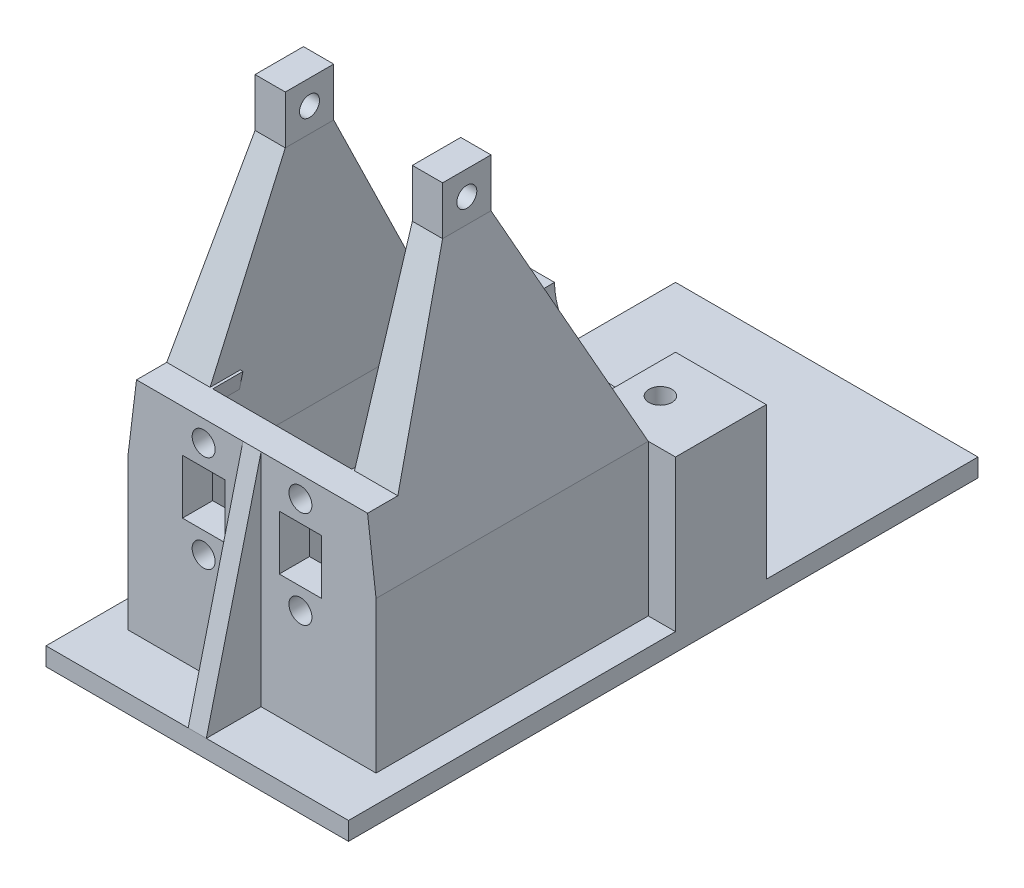
from build123d import *

# Parameters (mm, degrees)
MOTOR_MOUNT_SOLID_DEPTH              = 7.5
ENCODER_DISTANCE_SKETCH_W            = 50
ENCODER_DISTANCE_SKETCH_H            = 55
ENCODER_DISTANCE_SOLID_DEPTH         = 5
ENCODER_MOUNT_SKETCH_R               = 1.9
ENCODER_MOUNT_SKETCH_W               = 7
ENCODER_MOUNT_SKETCH_H               = 9
ENCODER_MOUNT_SOLID_DEPTH            = 5
MOTOR_CLAMP_MOUNTING_HOLES_SKETCH_R  = 1.9
MOTOR_CLAMP_MOUNTING_HOLES_CUT_DEPTH = 16
GUSSET_PLATE_SKETCH_W                = 50
GUSSET_PLATE_SKETCH_H                = 5
GUSSET_PLATE_SOLID_DEPTH             = 16.5
GUSSET_SOLID_DEPTH                   = 1.5
MOUNTING_PLATE_SKETCH_W              = 50
MOUNTING_PLATE_SKETCH_H              = 92
MOUNTING_PLATE_SKETCH_R              = 2.65
MOUNTING_PLATE_SOLID_DEPTH           = 5
MOUNTING_HOLES_CUT_DEPTH             = 100.036609393
MOUNTING_HOLES_CUT_DEPTH_BACK        = 100.036609393
MOUNTING_HOLE_SKETCH_R               = 2.65
MOUNTING_PLATE_TRIM_SKETCH_W         = 50
MOUNTING_PLATE_TRIM_SKETCH_H         = 15.5
MOUNTING_PLATE_TRIM_SKETCH_H_2       = 40
MOUNTING_PLATE_TRIM_SKETCH_W_2       = 23.5
MOUNTING_PLATE_TRIM_SKETCH_H_3       = 16.5
MOUNTING_PLATE_TRIM_CUT_DEPTH        = 2
CUT_EXTRUDE1_DEPTH                   = 105.216121594
CUT_EXTRUDE1_DEPTH_BACK              = 105.216121594
SKETCH1_W                            = 92
SKETCH1_H                            = 35
SKETCH2_W                            = 50
SKETCH2_H                            = 104.056390977
BOSS_EXTRUDE1_DEPTH                  = 3
SKETCH3_W                            = 8
SKETCH3_H                            = 40
BOSS_EXTRUDE2_DEPTH                  = 25
BOSS_EXTRUDE3_DEPTH                  = 40
CUT_EXTRUDE2_DEPTH                   = 89.489769297
CUT_EXTRUDE2_DEPTH_BACK              = 89.489769297
SKETCH5_R                            = 1.65
CUT_EXTRUDE3_DEPTH                   = 89.489769297
CUT_EXTRUDE3_DEPTH_BACK              = 89.489769297
BOSS_EXTRUDE4_DEPTH                  = 10


with BuildPart() as part:
    # Mouting Mount Sketch → Motor Mount Solid (new, symmetric)
    with BuildSketch(Plane.XY):
        with BuildLine():
            Line((-25, -55), (25, -55))
            Line((25, -55), (25, 0))
            Line((25, 0), (10, 0))
            ThreePointArc((10, 0), (0, -10), (-10, 0))
            Line((-10, 0), (-25, 0))
            Line((-25, 0), (-25, -55))
        make_face()
    extrude(amount=MOTOR_MOUNT_SOLID_DEPTH, both=True)

    # Encoder Distance Sketch → Encoder Distance Solid (add)
    with BuildSketch(Plane.XZ.offset(55)):
        with Locations((0, 20)):
            Rectangle(ENCODER_DISTANCE_SKETCH_W, ENCODER_DISTANCE_SKETCH_H)
    extrude(amount=ENCODER_DISTANCE_SOLID_DEPTH)

    # Encoder Mount Sketch → Encoder Mount Solid (add)
    with BuildSketch(Plane.XY.offset(47.5)):
        Polygon((-25, -60), (-25, -55), (-11.5, 11.5), (11.5, 11.5), (25, -55), (25, -60), align=None)
        with Locations((-8, 8)):
            Circle(ENCODER_MOUNT_SKETCH_R, mode=Mode.SUBTRACT)
        with Locations((8, 8)):
            Circle(ENCODER_MOUNT_SKETCH_R, mode=Mode.SUBTRACT)
        with Locations((-8, -8)):
            Circle(ENCODER_MOUNT_SKETCH_R, mode=Mode.SUBTRACT)
        with Locations((8, -8)):
            Circle(ENCODER_MOUNT_SKETCH_R, mode=Mode.SUBTRACT)
        with Locations((-8, 0)):
            Rectangle(ENCODER_MOUNT_SKETCH_W, ENCODER_MOUNT_SKETCH_H, mode=Mode.SUBTRACT)
        with Locations((8, 0)):
            Rectangle(ENCODER_MOUNT_SKETCH_W, ENCODER_MOUNT_SKETCH_H, mode=Mode.SUBTRACT)
    extrude(amount=ENCODER_MOUNT_SOLID_DEPTH)

    # Motor Clamp Mounting Holes Sketch → Motor Clamp Mounting Holes Cut (cut)
    with BuildSketch(Plane(origin=(0, 0, 0), x_dir=(1, 0, 0), z_dir=(0, 1, 0))):
        with Locations(Location((-15, 0, 0), (0, 0, 180))):
            Circle(MOTOR_CLAMP_MOUNTING_HOLES_SKETCH_R)
        with Locations(Location((15, 0, 0), (0, 0, 180))):
            Circle(MOTOR_CLAMP_MOUNTING_HOLES_SKETCH_R)
    extrude(amount=-MOTOR_CLAMP_MOUNTING_HOLES_CUT_DEPTH, mode=Mode.SUBTRACT)

    # Gusset Plate Sketch → Gusset Plate Solid (add)
    with BuildSketch(Plane.XY.offset(52.5)):
        with Locations((0, -57.5)):
            Rectangle(GUSSET_PLATE_SKETCH_W, GUSSET_PLATE_SKETCH_H)
    extrude(amount=GUSSET_PLATE_SOLID_DEPTH)

    # Gusset Sketch → Gusset Solid (add, symmetric)
    with BuildSketch(Plane(origin=(0, 0, 0), x_dir=(0, 0, -1), z_dir=(1, 0, 0))):
        Polygon((-52.5, 11.5), (-69, -55), (-52.5, -55), align=None)
    extrude(amount=GUSSET_SOLID_DEPTH, both=True)

    # Mounting Plate Sketch → Mounting Plate Solid (add)
    with BuildSketch(Plane(origin=(0, -55, 0), x_dir=(1, 0, 0), z_dir=(0, 1, 0))):
        with Locations((0, -23)):
            Rectangle(MOUNTING_PLATE_SKETCH_W, MOUNTING_PLATE_SKETCH_H)
        with Locations((-19, -63)):
            Circle(MOUNTING_PLATE_SKETCH_R, mode=Mode.SUBTRACT)
        with Locations((19, -63)):
            Circle(MOUNTING_PLATE_SKETCH_R, mode=Mode.SUBTRACT)
        with Locations(Location((-19, 17, 0), (0, 0, 270))):
            Circle(MOUNTING_PLATE_SKETCH_R, mode=Mode.SUBTRACT)
        with Locations(Location((19, 17, 0), (0, 0, 270))):
            Circle(MOUNTING_PLATE_SKETCH_R, mode=Mode.SUBTRACT)
    extrude(amount=-MOUNTING_PLATE_SOLID_DEPTH)

    # Mounting Hole Sketch → Mounting Holes Cut (cut, two sides: drawn at the far end of the back side and taken through both)
    with BuildSketch(Plane(origin=(0, -55, 0), x_dir=(1, 0, 0), z_dir=(0, 1, 0)).offset(-MOUNTING_HOLES_CUT_DEPTH_BACK)):
        with Locations(Location((-19, 17, 0), (0, 0, 270))):
            Circle(MOUNTING_HOLE_SKETCH_R)
        with Locations(Location((19, 17, 0), (0, 0, 270))):
            Circle(MOUNTING_HOLE_SKETCH_R)
        with Locations(Location((19, -63, 0), (0, 0, 90))):
            Circle(MOUNTING_HOLE_SKETCH_R)
        with Locations(Location((-19, -63, 0), (0, 0, 90))):
            Circle(MOUNTING_HOLE_SKETCH_R)
    extrude(amount=MOUNTING_HOLES_CUT_DEPTH + MOUNTING_HOLES_CUT_DEPTH_BACK, mode=Mode.SUBTRACT)

    # Mounting Plate Trim Sketch → Mounting Plate Trim Cut (cut)
    with BuildSketch(Plane(origin=(0, -55, 0), x_dir=(1, 0, 0), z_dir=(0, 1, 0))):
        with Locations((0, 15.25)):
            Rectangle(MOUNTING_PLATE_TRIM_SKETCH_W, MOUNTING_PLATE_TRIM_SKETCH_H)
        with Locations((0, -27.5)):
            Rectangle(MOUNTING_PLATE_TRIM_SKETCH_W, MOUNTING_PLATE_TRIM_SKETCH_H_2)
        with Locations((13.25, -60.75)):
            Rectangle(MOUNTING_PLATE_TRIM_SKETCH_W_2, MOUNTING_PLATE_TRIM_SKETCH_H_3)
        with Locations((-13.25, -60.75)):
            Rectangle(MOUNTING_PLATE_TRIM_SKETCH_W_2, MOUNTING_PLATE_TRIM_SKETCH_H_3)
    extrude(amount=-MOUNTING_PLATE_TRIM_CUT_DEPTH, mode=Mode.SUBTRACT)

    # Sketch1 → Cut-Extrude1 (cut, two sides: drawn at the far end of the back side and taken through both)
    with BuildSketch(Plane.ZY.offset(25).offset(-CUT_EXTRUDE1_DEPTH_BACK)):
        with Locations((23, -42.5)):
            Rectangle(SKETCH1_W, SKETCH1_H)
    extrude(amount=CUT_EXTRUDE1_DEPTH + CUT_EXTRUDE1_DEPTH_BACK, mode=Mode.SUBTRACT)


with BuildPart() as cut_extrude1_piece_1:
    # of the separate pieces the step leaves, piece 1, a body of its own (cut_extrude1_pieces)
    add(part.part.solids().sort_by_distance((-25, -25, -7.5))[0])



with BuildPart() as cut_extrude1_piece_2:
    # of the separate pieces the step leaves, piece 2, a body of its own (cut_extrude1_pieces)
    add(part.part.solids().sort_by_distance((11.5, 11.5, 47.5))[0])


with BuildPart() as cut_extrude1_piece_1_1:
    add(cut_extrude1_piece_1.part)

    add(cut_extrude1_piece_2.part)  # Boss-Extrude1 merges Cut-Extrude1 piece 2
    # Sketch2 → Boss-Extrude1 (add)
    with BuildSketch(Plane.XZ.offset(25)):
        with Locations((0, 9.528195489)):
            Rectangle(SKETCH2_W, SKETCH2_H)
    extrude(amount=BOSS_EXTRUDE1_DEPTH)

    # Sketch3 → Boss-Extrude2 (add)
    with BuildSketch(Plane(origin=(0, -25, 0), x_dir=(1, 0, 0), z_dir=(0, 1, 0))):
        with Locations((16.5, -27.5)):
            Rectangle(SKETCH3_W, SKETCH3_H)
        with Locations((-16.5, -27.5)):
            Rectangle(SKETCH3_W, SKETCH3_H)
    extrude(amount=BOSS_EXTRUDE2_DEPTH)

    # Sketch4 → Boss-Extrude3 (add)
    with BuildSketch(Plane.XY.offset(47.5)):
        Polygon((-15.5, 41), (-20.5, 0), (-12.5, 0), (-10.5, 41), (-10.5, 49), (-15.5, 49), align=None)
        Polygon((10.5, 49), (10.5, 41), (12.5, 0), (20.5, 0), (15.5, 41), (15.5, 49), align=None)
    extrude(amount=-BOSS_EXTRUDE3_DEPTH)

    # Sketch5 → Cut-Extrude2 (cut, two sides: drawn at the far end of the back side and taken through both)
    with BuildSketch(Plane.ZY.offset(15.5).offset(-CUT_EXTRUDE2_DEPTH_BACK)):
        with Locations((32.5, 45)):
            Circle(SKETCH5_R)
    extrude(amount=CUT_EXTRUDE2_DEPTH + CUT_EXTRUDE2_DEPTH_BACK, mode=Mode.SUBTRACT)

    # Sketch6 → Cut-Extrude3 (cut, two sides: drawn at the far end of the back side and taken through both)
    with BuildSketch(Plane.ZY.offset(15.5).offset(-CUT_EXTRUDE3_DEPTH_BACK)):
        Polygon((36.5, 41), (47.5, 11.5), (52.5, 11.5), (52.5, 49), (36.5, 49), align=None)
        Polygon((7.5, 0), (28.5, 41), (28.5, 49), (7.5, 49), align=None)
    extrude(amount=CUT_EXTRUDE3_DEPTH + CUT_EXTRUDE3_DEPTH_BACK, mode=Mode.SUBTRACT)

    # Sketch7 → Boss-Extrude4 (add)
    with BuildSketch(Plane.XY.offset(52.5)):
        Polygon((-11.5, 11.5), (-19.097560976, 11.5), (-20.5, 0), (-20.5, -25), (-18.909774436, -25), align=None)
        Polygon((11.5, 11.5), (18.909774436, -25), (20.5, -25), (20.5, 0), (19.097560976, 11.5), align=None)
    extrude(amount=-BOSS_EXTRUDE4_DEPTH)


solid = cut_extrude1_piece_1_1.part
